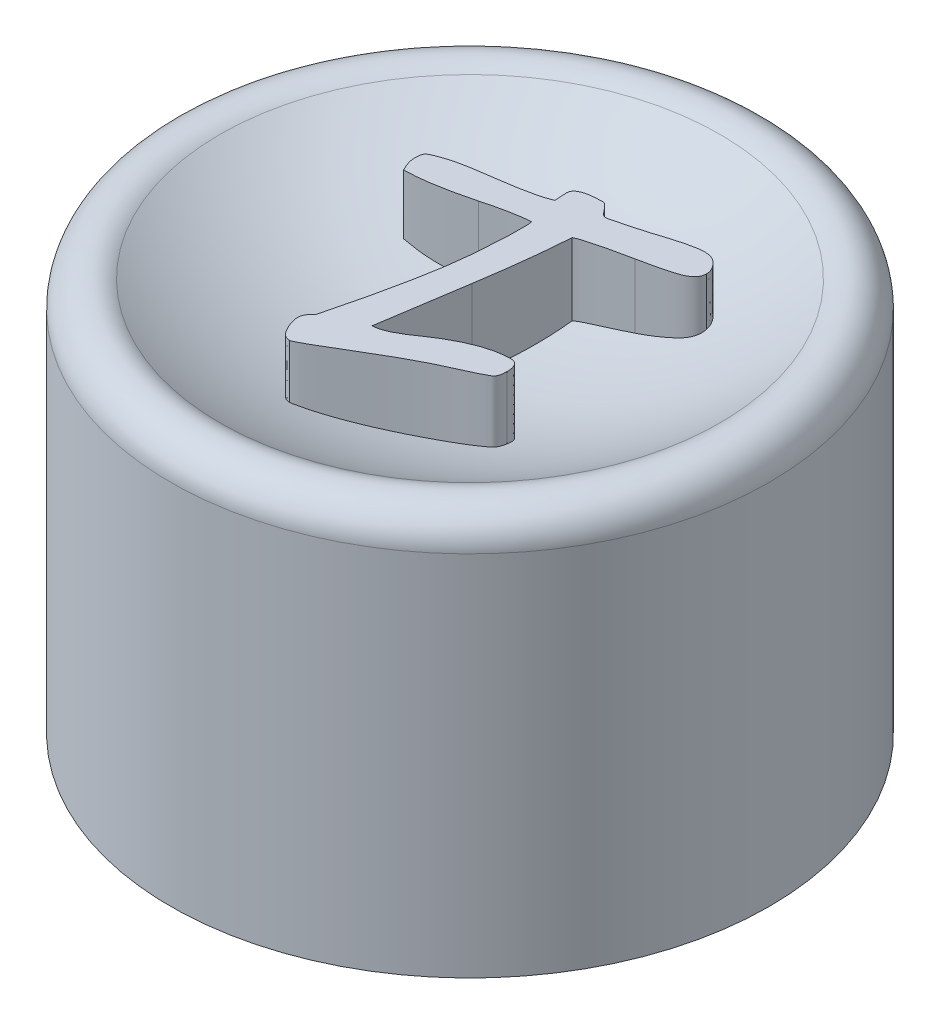
from build123d import *

# Parameters (mm, degrees)
BOSS_EXTRUDE1_REACH      = 11.257
BOSS_EXTRUDE1_END_RADIUS = 7.2532875


with BuildPart() as part:
    # Sketch1 → Revolve1 (revolve)
    with BuildSketch(Plane.XY):
        with BuildLine():
            Line((-1.5494, 0), (-1.5494, 3.048))
            Line((-1.5494, 3.048), (-0.762, 3.048))
            Line((-0.762, 3.048), (-0.762, 4.064))
            Line((-0.762, 4.064), (0, 4.064))
            Line((0, 4.064), (0, 5.08))
            ThreePointArc((0, 5.08), (-2.074697908, 5.383049508), (-3.976029965, 6.266874616))
            ThreePointArc((-3.976029965, 6.266874616), (-4.495955195, 6.288948978), (-4.7625, 5.842))
            Line((-4.7625, 5.842), (-4.7625, 0))
            Line((-4.7625, 0), (-3.4925, 0))
            Line((-3.4925, 0), (-3.4925, 4.064))
            Line((-3.4925, 4.064), (-2.0574, 4.064))
            Line((-2.0574, 4.064), (-2.0574, 0))
            Line((-2.0574, 0), (-1.5494, 0))
        make_face()
    revolve(axis=Axis((0, 0, 0), (0, -1, 0)))

    # Boss-Extrude1: up to this sphere (the profile starts inside it)
    boss_extrude1_end = Location((0, 12.3332875, 0)) * Sphere(BOSS_EXTRUDE1_END_RADIUS, mode=Mode.PRIVATE)
    # Sketch3 → Boss-Extrude1 (add, up to the surface)
    with BuildSketch(Plane(origin=(0, 6.35, 0), x_dir=(-1, 0, 0), z_dir=(0, 1, 0)), mode=Mode.PRIVATE) as boss_extrude1_sk1:
        with BuildLine():
            Line((0.319321104, -1.670291139), (0.331566456, -1.862448972))
            add(Edge.make_bspline(
                [(0.331566456, -1.862448972), (0.330264847, -1.875860405), (0.327677522, -1.90251953), (0.307167622, -1.939780736), (0.272178018, -1.968931859), (0.225289091, -1.992324846), (0.166464611, -2.010650765), (0.094675746, -2.023451873), (0.01018255, -2.030339994), (-0.05053892, -2.03142298), (-0.082891614, -2.032)],
                knots=[0, 0, 0, 0, 0.654621416, 1.301250485, 2.020064252, 2.852117257, 3.853681923, 5.026660573, 6.415790301, 8, 8, 8, 8], degree=3))
            add(Edge.make_bspline(
                [(-0.082891614, -2.032), (-0.09129755, -2.030352055), (-0.111570762, -2.026377586), (-0.14019296, -2.002167243), (-0.174135585, -1.968376272), (-0.19656441, -1.939712563), (-0.209112935, -1.923675732)],
                knots=[0, 0, 0, 0, 0.596656741, 1.439000711, 2.567166814, 4, 4, 4, 4], degree=3))
            add(Edge.make_bspline(
                [(-0.209112935, -1.923675732), (-0.220801123, -1.908958465), (-0.241494066, -1.882902795), (-0.271192851, -1.85255868), (-0.298434155, -1.83398067), (-0.315710867, -1.834787752), (-0.323088904, -1.835132417)],
                knots=[0, 0, 0, 0, 1.495927964, 2.648413359, 3.422803596, 4, 4, 4, 4], degree=3))
            add(Edge.make_bspline(
                [(-0.323088904, -1.835132417), (-0.327502788, -1.835320716), (-0.339318564, -1.835824784), (-0.360706501, -1.841825961), (-0.39104336, -1.847676866), (-0.429888721, -1.857591038), (-0.477505931, -1.869904065), (-0.534338389, -1.883470034), (-0.598956192, -1.902156804), (-0.67018926, -1.920619777), (-0.741191595, -1.941077839), (-0.8077569, -1.958471266), (-0.865716045, -1.97558331), (-0.91598617, -1.990551001), (-0.958147573, -2.004170686), (-0.993352122, -2.01401285), (-1.020364243, -2.023220083), (-1.035537499, -2.029435835), (-1.041796875, -2.032)],
                knots=[0, 0, 0, 0, 0.283634754, 0.759277869, 1.421229402, 2.274051199, 3.337621536, 4.587425942, 6.033685089, 7.666047516, 9.323238173, 10.78899013, 12.093628619, 13.212400574, 14.1647594, 14.944804056, 15.564703353, 16, 16, 16, 16], degree=3))
            add(Edge.make_bspline(
                [(-1.041796875, -2.032), (-1.072538334, -2.04151463), (-1.131379088, -2.059726127), (-1.216432169, -2.084405881), (-1.294335711, -2.105078727), (-1.36498022, -2.122131864), (-1.428391941, -2.13560056), (-1.484945496, -2.145081782), (-1.5346175, -2.151203152), (-1.565507498, -2.152140471), (-1.579650415, -2.15256962)],
                knots=[0, 0, 0, 0, 1.397205474, 2.674324071, 3.844914688, 4.896404106, 5.829524582, 6.658771343, 7.385921425, 8, 8, 8, 8], degree=3))
            add(Edge.make_bspline(
                [(-1.579650415, -2.15256962), (-1.602676052, -2.151215311), (-1.647265931, -2.148592649), (-1.711074023, -2.130787536), (-1.766694537, -2.098707797), (-1.813467539, -2.05631357), (-1.849660508, -2.008018946), (-1.878257677, -1.959816712), (-1.895052723, -1.911247343), (-1.897702883, -1.878883535), (-1.898971519, -1.863390922)],
                knots=[0, 0, 0, 0, 1.16540409, 2.256842108, 3.3172977, 4.386292102, 5.428855011, 6.361189118, 7.215498274, 8, 8, 8, 8], degree=3))
            add(Edge.make_bspline(
                [(-1.898971519, -1.863390922), (-1.89804857, -1.849765649), (-1.896222083, -1.822801673), (-1.881906263, -1.784069172), (-1.860291009, -1.747572928), (-1.82780874, -1.715166298), (-1.78695029, -1.686507462), (-1.73808064, -1.659726356), (-1.680161313, -1.636388134), (-1.592370143, -1.610469792), (-1.481276476, -1.581550401), (-1.353363945, -1.548945973), (-1.234557147, -1.522582668), (-1.158316175, -1.50780557), (-1.121862638, -1.500740111)],
                knots=[0, 0, 0, 0, 0.53689895, 1.062505692, 1.61340383, 2.201050032, 2.858497295, 3.580081632, 4.397703734, 5.319582692, 7.19383169, 8.932477584, 10.533307751, 12, 12, 12, 12], degree=3))
            add(Edge.make_bspline(
                [(-1.121862638, -1.500740111), (-1.068454867, -1.489895464), (-0.967486312, -1.469393423), (-0.824959992, -1.438160268), (-0.699873759, -1.40937644), (-0.592607497, -1.381867744), (-0.502567499, -1.357771474), (-0.429982259, -1.335237591), (-0.374226821, -1.315597525), (-0.344033157, -1.300632114), (-0.331566456, -1.294453026)],
                knots=[0, 0, 0, 0, 1.598349495, 3.021714536, 4.279329332, 5.362580562, 6.269599746, 7.012331293, 7.592200192, 8, 8, 8, 8], degree=3))
            add(Edge.make_bspline(
                [(-0.331566456, -1.294453026), (-0.323749997, -1.186697154), (-0.307549002, -0.96335403), (-0.269167515, -0.617788436), (-0.223919745, -0.248909827), (-0.18557618, 0.003955998), (-0.165783228, 0.134485364)],
                knots=[0, 0, 0, 0, 0.900898926, 1.867272546, 2.899085861, 4, 4, 4, 4], degree=3))
            Line((-0.165783228, 0.134485364), (0.045213608, 1.510674545))
            add(Edge.make_bspline(
                [(0.045213608, 1.510674545), (0.028832596, 1.509863992), (-0.005844082, 1.508148147), (-0.059830899, 1.495899244), (-0.117931033, 1.476811118), (-0.181051554, 1.451000697), (-0.248268388, 1.41704018), (-0.319591718, 1.375255081), (-0.395865678, 1.326880012), (-0.44697064, 1.290512356), (-0.47380093, 1.271419205)],
                knots=[0, 0, 0, 0, 0.678520234, 1.436347594, 2.283898981, 3.211633743, 4.258921084, 5.401435955, 6.635744489, 8, 8, 8, 8], degree=3))
            add(Edge.make_bspline(
                [(-0.47380093, 1.271419205), (-0.521778807, 1.238802887), (-0.614927313, 1.175478674), (-0.756657863, 1.09303788), (-0.89297846, 1.021631071), (-1.025545135, 0.96386561), (-1.153477308, 0.918099123), (-1.277302964, 0.885779727), (-1.396588383, 0.865984228), (-1.474711412, 0.863083893), (-1.512771954, 0.861670886)],
                knots=[0, 0, 0, 0, 1.228444074, 2.385010266, 3.470684385, 4.486288526, 5.445429724, 6.345503381, 7.193950382, 8, 8, 8, 8], degree=3))
            add(Edge.make_bspline(
                [(-1.512771954, 0.861670886), (-1.524199198, 0.861941785), (-1.546031627, 0.862459353), (-1.575973741, 0.873961762), (-1.602435173, 0.889520686), (-1.622584861, 0.913852609), (-1.638649395, 0.94323968), (-1.649650891, 0.979441319), (-1.657435865, 1.021468897), (-1.657695372, 1.051902339), (-1.657832278, 1.067957971)],
                knots=[0, 0, 0, 0, 0.951238837, 1.817398486, 2.657551146, 3.497291055, 4.428268853, 5.452513686, 6.656034311, 8, 8, 8, 8], degree=3))
            add(Edge.make_bspline(
                [(-1.657832278, 1.067957971), (-1.65747586, 1.088094749), (-1.656824869, 1.124874175), (-1.647895607, 1.174739279), (-1.632393136, 1.213840123), (-1.611714585, 1.239633211), (-1.58699455, 1.256935279), (-1.557715984, 1.273330175), (-1.51767743, 1.294096977), (-1.467205494, 1.319394707), (-1.405481553, 1.348542248), (-1.333366478, 1.382357183), (-1.250262221, 1.420280682), (-1.156303517, 1.460772107), (-1.054179566, 1.507752759), (-0.944948348, 1.560615232), (-0.828869997, 1.618950785), (-0.706844687, 1.683907108), (-0.578441457, 1.755166152), (-0.442840509, 1.830768715), (-0.301715234, 1.914208205), (-0.158098324, 2.000238732), (-0.019657431, 2.084013467), (0.105604797, 2.158766681), (0.213688688, 2.222633894), (0.304380659, 2.2741952), (0.378560384, 2.314434619), (0.435052489, 2.342766967), (0.474009115, 2.362458315), (0.495391889, 2.367128986), (0.503001384, 2.368791139)],
                knots=[0, 0, 0, 0, 0.654590794, 1.195597087, 1.639644446, 2.00985234, 2.250976601, 2.617215843, 3.10162402, 3.718449178, 4.454197988, 5.322622829, 6.31021975, 7.426421547, 8.651623993, 9.967644576, 11.374927169, 12.878597267, 14.465356253, 16.153349762, 17.930126775, 19.799682713, 21.600906984, 23.195376773, 24.546348096, 25.685597327, 26.5906895, 27.289772944, 27.747251246, 28, 28, 28, 28], degree=3))
            add(Edge.make_bspline(
                [(0.503001384, 2.368791139), (0.520032428, 2.367246538), (0.554668266, 2.364105301), (0.602200853, 2.33373554), (0.644659341, 2.288151212), (0.680474873, 2.227962354), (0.712356979, 2.163750238), (0.734981009, 2.099741601), (0.750466047, 2.040469899), (0.752566027, 2.001826661), (0.753560127, 1.983533525)],
                knots=[0, 0, 0, 0, 0.818479793, 1.66453302, 2.655215465, 3.825269078, 5.044130064, 6.127679587, 7.113671274, 8, 8, 8, 8], degree=3))
            add(Edge.make_bspline(
                [(0.753560127, 1.983533525), (0.752171978, 1.96857984), (0.749253288, 1.937138557), (0.727474803, 1.891157724), (0.693515218, 1.845283137), (0.663969761, 1.817589875), (0.648061709, 1.802679094)],
                knots=[0, 0, 0, 0, 0.831421031, 1.748127321, 2.787532476, 4, 4, 4, 4], degree=3))
            add(Edge.make_bspline(
                [(0.648061709, 1.802679094), (0.619621872, 1.690318929), (0.564553804, 1.472755891), (0.487585354, 1.156223851), (0.421794503, 0.859667825), (0.365315893, 0.583259732), (0.31653144, 0.327554705), (0.27886474, 0.091609232), (0.250105266, -0.12382405), (0.231368716, -0.319328402), (0.219680599, -0.494692666), (0.21048672, -0.650457188), (0.202129933, -0.786987261), (0.198671919, -0.904450155), (0.197036269, -1.002800238), (0.19955579, -1.081543143), (0.201184311, -1.141674014), (0.208147091, -1.174555033), (0.210996835, -1.188012658)],
                knots=[0, 0, 0, 0, 1.832922188, 3.54908807, 5.151340611, 6.636391058, 8.010513144, 9.267649762, 10.414440134, 11.447062428, 12.372878208, 13.193671025, 13.914747713, 14.535739304, 15.052163851, 15.46937491, 15.782824442, 16, 16, 16, 16], degree=3))
            add(Edge.make_bspline(
                [(0.210996835, -1.188012658), (0.232688727, -1.187071508), (0.278088116, -1.185101757), (0.349246462, -1.175455331), (0.427538022, -1.164548713), (0.512686287, -1.149488883), (0.604210659, -1.130118899), (0.702754723, -1.108907299), (0.807679812, -1.082005801), (0.880104325, -1.063076925), (0.917459454, -1.053313786)],
                knots=[0, 0, 0, 0, 0.722889133, 1.512948923, 2.390079769, 3.356457061, 4.392329893, 5.506358455, 6.713829061, 8, 8, 8, 8], degree=3))
            add(Edge.make_bspline(
                [(0.917459454, -1.053313786), (0.968897685, -1.040213444), (1.069348156, -1.014630614), (1.216727997, -0.981116608), (1.356316311, -0.951406018), (1.488239272, -0.927698553), (1.612708611, -0.909974125), (1.729187128, -0.896384071), (1.83826682, -0.888610212), (1.908380392, -0.88724776), (1.942301226, -0.886588608)],
                knots=[0, 0, 0, 0, 1.223854286, 2.389987682, 3.484717629, 4.514310817, 5.479802041, 6.383230137, 7.217809317, 8, 8, 8, 8], degree=3))
            add(Edge.make_bspline(
                [(1.942301226, -0.886588608), (1.954064015, -0.909933836), (1.97638494, -0.954233458), (2.000864268, -1.019806648), (2.016409377, -1.080224025), (2.018534933, -1.118858406), (2.019541139, -1.13714735)],
                knots=[0, 0, 0, 0, 1.184904396, 2.248460168, 3.170847011, 4, 4, 4, 4], degree=3))
            add(Edge.make_bspline(
                [(2.019541139, -1.13714735), (2.019199601, -1.153481905), (2.018573111, -1.183444665), (2.013808361, -1.223927484), (2.003807519, -1.255201798), (1.987696477, -1.280175421), (1.957996876, -1.299140748), (1.914731557, -1.320133422), (1.852442347, -1.343881091), (1.789619245, -1.367598227), (1.727870947, -1.38699008), (1.671258706, -1.401863566), (1.606510706, -1.416755226), (1.533936965, -1.431672251), (1.453663309, -1.447153739), (1.364873714, -1.460479954), (1.268357234, -1.476214993), (1.201015549, -1.484925099), (1.166134296, -1.489436709)],
                knots=[0, 0, 0, 0, 0.783280171, 1.436784517, 1.946110164, 2.346899281, 2.831609506, 3.605724787, 4.659468882, 6.021316993, 6.825857514, 7.760533996, 8.826675507, 10.010432764, 11.312317784, 12.745102261, 14.314047075, 16, 16, 16, 16], degree=3))
            add(Edge.make_bspline(
                [(1.166134296, -1.489436709), (1.11524624, -1.496506158), (1.017776946, -1.510046747), (0.878382524, -1.531862797), (0.752260464, -1.552836035), (0.639681085, -1.575998605), (0.540122058, -1.597719913), (0.454427113, -1.621374892), (0.381941003, -1.644542938), (0.339010432, -1.662195234), (0.319321104, -1.670291139)],
                knots=[0, 0, 0, 0, 1.420357408, 2.72050543, 3.900714232, 4.954503238, 5.897935755, 6.717136742, 7.411637998, 8, 8, 8, 8], degree=3))
        make_face()
    boss_extrude1_tool1 = extrude(boss_extrude1_sk1.sketch, amount=-BOSS_EXTRUDE1_REACH, mode=Mode.PRIVATE) & boss_extrude1_end
    add(boss_extrude1_tool1.solids().sort_by_distance((0.069994, 6.35, -0.177907))[0])


solid = part.part
